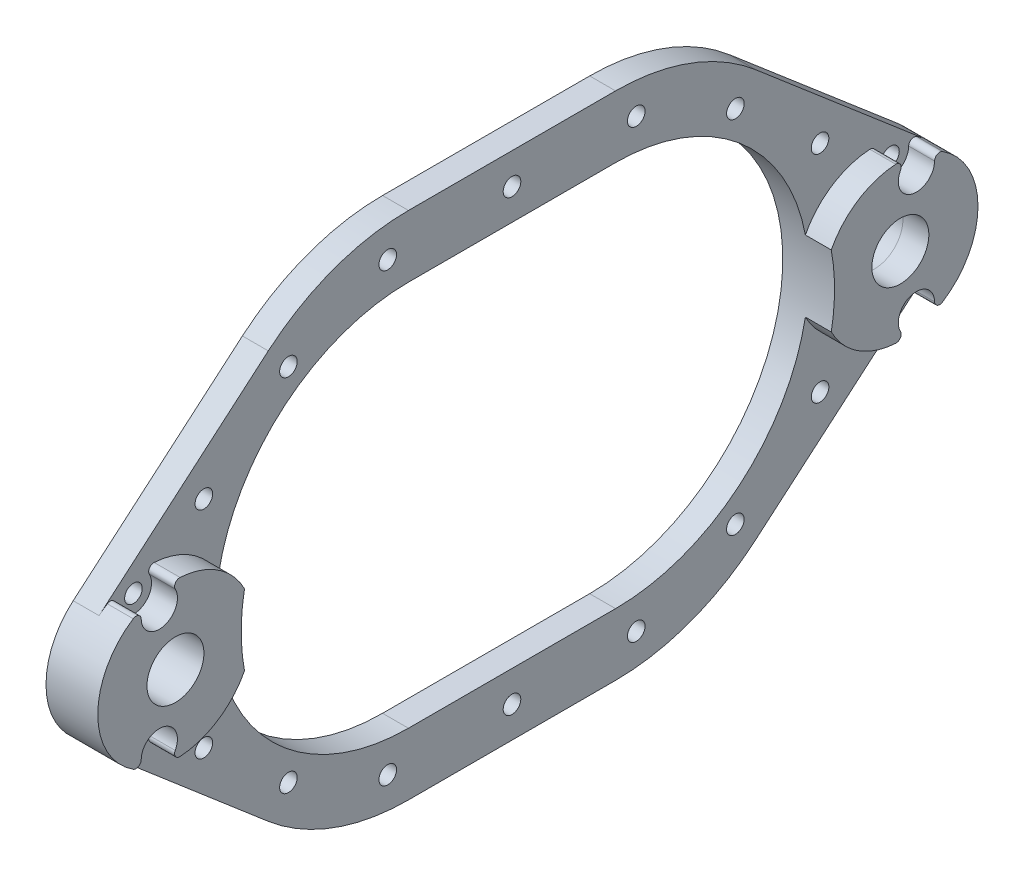
from build123d import *

# Parameters (mm, degrees)
SKETCH1_R               = 19.05
BOSS_EXTRUDE1_DEPTH     = 6.35
SKETCH3_R               = 6.985
CUT_EXTRUDE2_DEPTH      = 6.35
CUT_EXTRUDE1_DEPTH      = 6.35
CUT_EXTRUDE3_DEPTH      = 125.954641054
CUT_EXTRUDE3_DEPTH_BACK = 125.954641054
SKETCH4_R               = 2.159
SKETCH6_R               = 6.985
BOSS_EXTRUDE2_DEPTH     = 6.35


with BuildPart() as part:
    # Sketch1 → Boss-Extrude1 (new body)
    with BuildSketch(Plane(origin=(0, 0, 0), x_dir=(0, 0, -1), z_dir=(1, 0, 0))):
        with BuildLine():
            Line((25.4, 62.611), (-25.4, 62.611))
            ThreePointArc((-25.4, 62.611), (-43.71389723, 59.350669702), (-59.777434529, 49.970298982))
            Line((-59.777434529, 49.970298982), (-101.281034529, 14.478))
            ThreePointArc((-101.281034529, 14.478), (-80.929937509, 17.302618411), (-69.85, 0))
            ThreePointArc((-69.85, 0), (-80.929937509, -17.302618411), (-101.281034529, -14.478))
            Line((-101.281034529, -14.478), (-59.777434529, -49.970298982))
            ThreePointArc((-59.777434529, -49.970298982), (-43.71389723, -59.350669702), (-25.4, -62.611))
            Line((-25.4, -62.611), (25.4, -62.611))
            ThreePointArc((25.4, -62.611), (43.699078076, -59.34404997), (59.737214243, -49.946847768))
            Line((59.737214243, -49.946847768), (101.269374674, -14.487973703))
            ThreePointArc((101.269374674, -14.487973703), (69.85, -7.706e-06), (101.269379322, 14.48794821))
            Line((101.269379322, 14.48794821), (59.737230268, 49.9468356))
            ThreePointArc((59.737230268, 49.9468356), (43.699087699, 59.344046737), (25.4, 62.611))
        make_face()
        with Locations((88.9, -1.0762e-05)):
            Circle(SKETCH1_R)
        with Locations((-88.9, 0)):
            Circle(SKETCH1_R)
    extrude(amount=BOSS_EXTRUDE1_DEPTH)

    # Sketch3 → Cut-Extrude2 (cut)
    with BuildSketch(Plane(origin=(6.35, 0, 0), x_dir=(0, 0, -1), z_dir=(1, 0, 0))):
        with Locations((-88.9, 0)):
            Circle(SKETCH3_R)
        with Locations((88.9, -1.0762e-05)):
            Circle(SKETCH3_R)
    extrude(amount=-CUT_EXTRUDE2_DEPTH, mode=Mode.SUBTRACT)

    # Sketch2 → Cut-Extrude1 (cut)
    with BuildSketch(Plane(origin=(6.35, 0, 0), x_dir=(0, 0, -1), z_dir=(1, 0, 0))):
        with BuildLine():
            Line((-25.4, 47.371), (25.4, 47.371))
            ThreePointArc((25.4, 47.371), (72.771, 0), (25.4, -47.371))
            Line((25.4, -47.371), (-25.4, -47.371))
            ThreePointArc((-25.4, -47.371), (-72.771, 0), (-25.4, 47.371))
        make_face()
    extrude(amount=-CUT_EXTRUDE1_DEPTH, mode=Mode.SUBTRACT)

    # Sketch4 → Cut-Extrude3 (cut, two sides: drawn at the far end of the back side and taken through both)
    with BuildSketch(Plane(origin=(6.35, 0, 0), x_dir=(0, 0, -1), z_dir=(1, 0, 0)).offset(-CUT_EXTRUDE3_DEPTH_BACK)):
        with BuildLine():
            ThreePointArc((-73.940141084, 27.832575617), (-76.984164998, 28.070231704), (-77.221821084, 25.02620779))
            Line((-77.221821084, 25.02620779), (-73.940141084, 27.832575617))
        make_face()
        with BuildLine():
            Line((-73.940141084, 27.832575617), (-77.221821084, 25.02620779))
            ThreePointArc((-77.221821084, 25.02620779), (-74.833081546, 24.404070178), (-73.421981084, 26.429391704))
            ThreePointArc((-73.421981084, 26.429391704), (-73.555659559, 27.177291242), (-73.940141084, 27.832575617))
        make_face()
        with Locations((-54.833341451, 44.171983407)):
            Circle(SKETCH4_R)
        with Locations((-30.48, 54.706186836)):
            Circle(SKETCH4_R)
        with Locations((0, 54.991)):
            Circle(SKETCH4_R)
        with Locations((30.478659799, 54.70517335)):
            Circle(SKETCH4_R)
        with Locations((54.789478539, 44.151652011)):
            Circle(SKETCH4_R)
        with Locations((75.555553066, 26.422208316)):
            Circle(SKETCH4_R)
        with Locations((92.827553066, 14.992208316)):
            Circle(SKETCH4_R)
        with Locations((92.827553066, -14.992208316)):
            Circle(SKETCH4_R)
        with Locations((75.555553066, -26.422208316)):
            Circle(SKETCH4_R)
        with Locations((54.789478539, -44.151652011)):
            Circle(SKETCH4_R)
        with Locations((30.478659799, -54.70517335)):
            Circle(SKETCH4_R)
        with Locations((0, -54.991)):
            Circle(SKETCH4_R)
        with Locations((-30.48, -54.706186836)):
            Circle(SKETCH4_R)
        with Locations((-54.833341451, -44.171983407)):
            Circle(SKETCH4_R)
        with Locations((-75.580981084, -26.429391704)):
            Circle(SKETCH4_R)
        with Locations((-92.852981084, 14.999391704)):
            Circle(SKETCH4_R)
        with Locations((-92.852981084, -14.999391704)):
            Circle(SKETCH4_R)
    extrude(amount=CUT_EXTRUDE3_DEPTH + CUT_EXTRUDE3_DEPTH_BACK, mode=Mode.SUBTRACT)

    # Sketch6 → Boss-Extrude2 (add)
    with BuildSketch(Plane(origin=(6.35, 0, 0), x_dir=(0, 0, -1), z_dir=(1, 0, 0))):
        with BuildLine():
            ThreePointArc((-71.961883, 8.717952311), (-78.500282105, 15.960838565), (-87.767121516, 19.016284767))
            ThreePointArc((-87.767121516, 19.016284767), (-88.915797503, 18.427684462), (-88.956054378, 17.137612284))
            ThreePointArc((-88.956054378, 17.137612284), (-91.72021134, 10.701152796), (-97.297574405, 14.939265075))
            ThreePointArc((-97.297574405, 14.939265075), (-97.968420164, 16.041931303), (-99.257990941, 15.987949327))
            ThreePointArc((-99.257990941, 15.987949327), (-107.95, 0), (-99.257990941, -15.987949327))
            ThreePointArc((-99.257990941, -15.987949327), (-97.968420164, -16.041931303), (-97.297574405, -14.939265075))
            ThreePointArc((-97.297574405, -14.939265075), (-91.72021134, -10.701152796), (-88.956054378, -17.137612284))
            ThreePointArc((-88.956054378, -17.137612284), (-88.915797503, -18.427684462), (-87.767121516, -19.016284767))
            ThreePointArc((-87.767121516, -19.016284767), (-78.500282105, -15.960838565), (-71.961883, -8.717952311))
            ThreePointArc((-71.961883, -8.717952311), (-72.771, 0), (-71.961883, 8.717952311))
        make_face()
        with Locations((-88.9, 0)):
            Circle(SKETCH6_R, mode=Mode.SUBTRACT)
    boss_extrude2 = extrude(amount=BOSS_EXTRUDE2_DEPTH)

    # Mirror1: Boss-Extrude2 across plane
    add(boss_extrude2.mirror(Plane.XY))


solid = part.part
